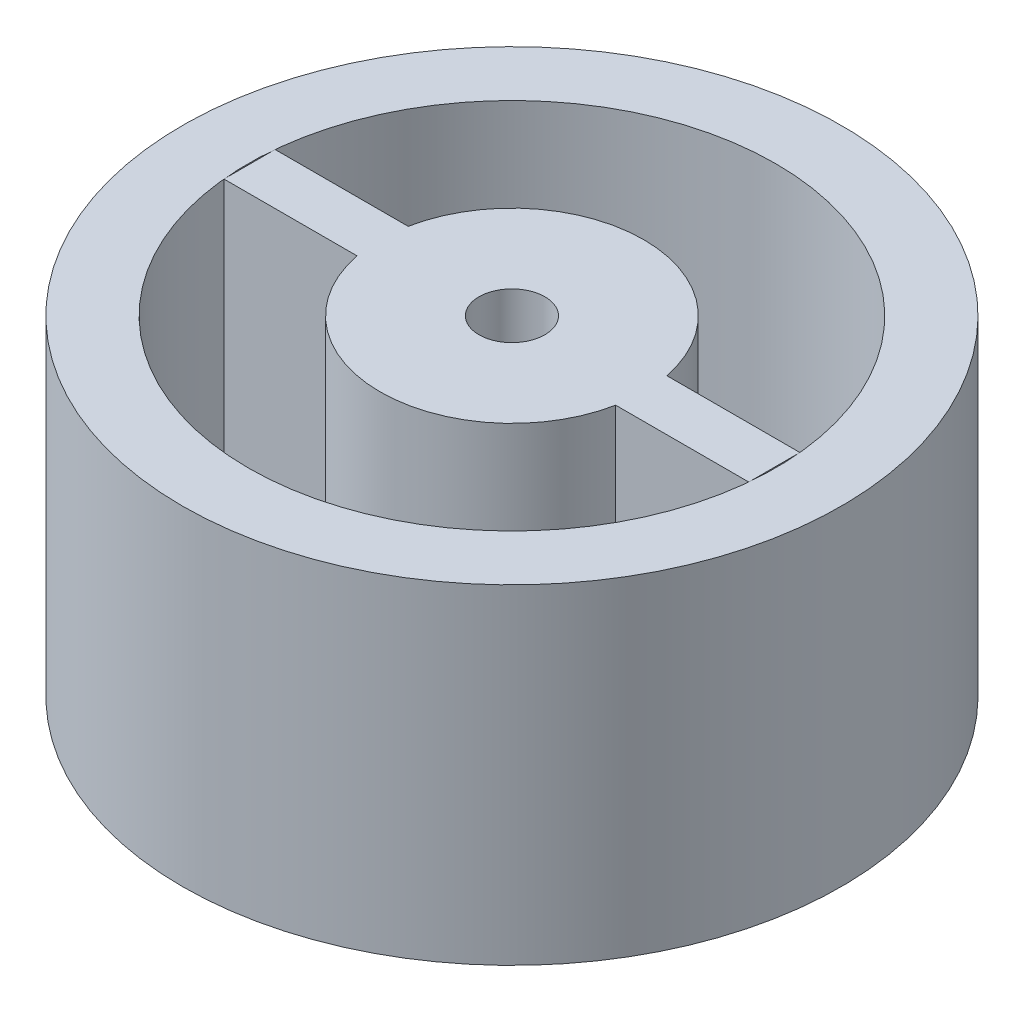
from build123d import *

# Parameters (mm, degrees)
SKETCH2_R               = 5
SKETCH2_R_2             = 0.5
BOSS_EXTRUDE1_DEPTH     = 5
CUT_EXTRUDE1_DEPTH      = 9.660254038
CUT_EXTRUDE1_DEPTH_BACK = 9.660254038
SKETCH4_R               = 4
SKETCH4_R_2             = 2
SKETCH5_W               = 7.962318844
SKETCH5_H               = 0.775550536
BOSS_EXTRUDE2_DEPTH     = 5
CUT_EXTRUDE2_DEPTH      = 9.660254038
CUT_EXTRUDE2_DEPTH_BACK = 9.660254038
SKETCH6_R               = 0.5
SCALE1_SCALE            = 6


with BuildPart() as part:
    # Sketch2 → Boss-Extrude1 (new body)
    with BuildSketch(Plane(origin=(0, 0, 0), x_dir=(1, 0, 0), z_dir=(0, 1, 0))):
        with Locations(Location((0, 0, 0), (0, 0, 270))):
            Circle(SKETCH2_R)
        with Locations(Location((0, 0, 0), (0, 0, 270))):
            Circle(SKETCH2_R_2, mode=Mode.SUBTRACT)
    extrude(amount=BOSS_EXTRUDE1_DEPTH)

    # Sketch4 → Cut-Extrude1 (cut, two sides: drawn at the far end of the back side and taken through both)
    with BuildSketch(Plane.XZ.offset(-CUT_EXTRUDE1_DEPTH_BACK)):
        with Locations(Location((0, 0, 0), (0, 0, 270))):
            Circle(SKETCH4_R)
        with Locations(Location((0, 0, 0), (0, 0, 270))):
            Circle(SKETCH4_R_2, mode=Mode.SUBTRACT)
    extrude(amount=CUT_EXTRUDE1_DEPTH + CUT_EXTRUDE1_DEPTH_BACK, mode=Mode.SUBTRACT)


with BuildPart() as cut_extrude1_piece_1:
    # of the separate pieces the step leaves, piece 1, a body of its own (cut_extrude1_pieces)
    add(part.part.solids().sort_by_distance((0, 0, 5))[0])


with BuildPart() as cut_extrude1_piece_2:
    # of the separate pieces the step leaves, piece 2, a body of its own (cut_extrude1_pieces)
    add(part.part.solids().sort_by_distance((0, 0, -2))[0])

    # Sketch5 → Boss-Extrude2 (add)
    with BuildSketch(Plane.XZ):
        Rectangle(SKETCH5_W, SKETCH5_H)
    extrude(amount=-BOSS_EXTRUDE2_DEPTH)

    # Sketch6 → Cut-Extrude2 (cut, two sides: drawn at the far end of the back side and taken through both)
    with BuildSketch(Plane.XZ.offset(-CUT_EXTRUDE2_DEPTH_BACK)):
        with Locations(Location((0, 0, 0), (0, 0, 90))):
            Circle(SKETCH6_R)
    extrude(amount=CUT_EXTRUDE2_DEPTH + CUT_EXTRUDE2_DEPTH_BACK, mode=Mode.SUBTRACT)


with BuildPart() as cut_extrude1_piece_2_1:
    # Scale1: scaled about (0, 2.5, 0)
    add(cut_extrude1_piece_2.part.scale(SCALE1_SCALE).moved(Location((0, -12.5, 0))))


with BuildPart() as cut_extrude1_piece_1_1:
    # Scale1: scaled about (0, 2.5, 0)
    add(cut_extrude1_piece_1.part.scale(SCALE1_SCALE).moved(Location((0, -12.5, 0))))


solid = Compound([cut_extrude1_piece_2_1.part, cut_extrude1_piece_1_1.part])
